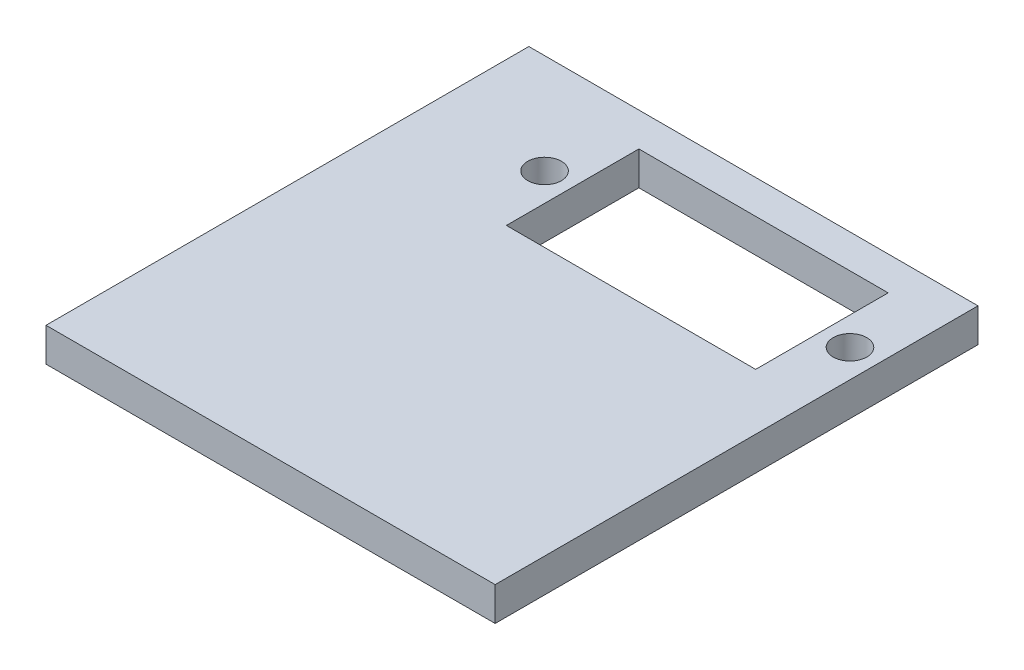
from build123d import *

# Parameters (mm, degrees)
SKETCH1_W           = 40
SKETCH1_H           = 40
BOSS_EXTRUDE1_DEPTH = 3
SKETCH2_W           = 40
SKETCH2_H           = 3
BOSS_EXTRUDE2_DEPTH = 3
SKETCH3_W           = 22.2
SKETCH3_H           = 11.8
CUT_EXTRUDE1_DEPTH  = 10
SKETCH4_R           = 1.5
CUT_EXTRUDE2_DEPTH  = 10


with BuildPart() as part:
    # Sketch1 → Boss-Extrude1 (new body)
    with BuildSketch(Plane(origin=(0, 0, 0), x_dir=(1, 0, 0), z_dir=(0, 1, 0))):
        with Locations((20, 20)):
            Rectangle(SKETCH1_W, SKETCH1_H)
    extrude(amount=BOSS_EXTRUDE1_DEPTH)

    # Sketch2 → Boss-Extrude2 (add)
    with BuildSketch(Plane(origin=(0, 0, -40), x_dir=(-1, 0, 0), z_dir=(0, 0, -1))):
        with Locations((-20, 1.5)):
            Rectangle(SKETCH2_W, SKETCH2_H)
    extrude(amount=BOSS_EXTRUDE2_DEPTH)

    # Sketch3 → Cut-Extrude1 (cut)
    with BuildSketch(Plane(origin=(0, 3, 0), x_dir=(1, 0, 0), z_dir=(0, 1, 0))):
        with Locations((23.9, 34.1)):
            Rectangle(SKETCH3_W, SKETCH3_H)
    extrude(amount=-CUT_EXTRUDE1_DEPTH, mode=Mode.SUBTRACT)

    # Sketch4 → Cut-Extrude2 (cut)
    with BuildSketch(Plane(origin=(0, 3, 0), x_dir=(1, 0, 0), z_dir=(0, 1, 0))):
        with Locations(Location((10.3, 34.1, 0), (0, 0, 270))):
            Circle(SKETCH4_R)
        with Locations(Location((37.5, 34.1, 0), (0, 0, 270))):
            Circle(SKETCH4_R)
    extrude(amount=-CUT_EXTRUDE2_DEPTH, mode=Mode.SUBTRACT)


solid = part.part
